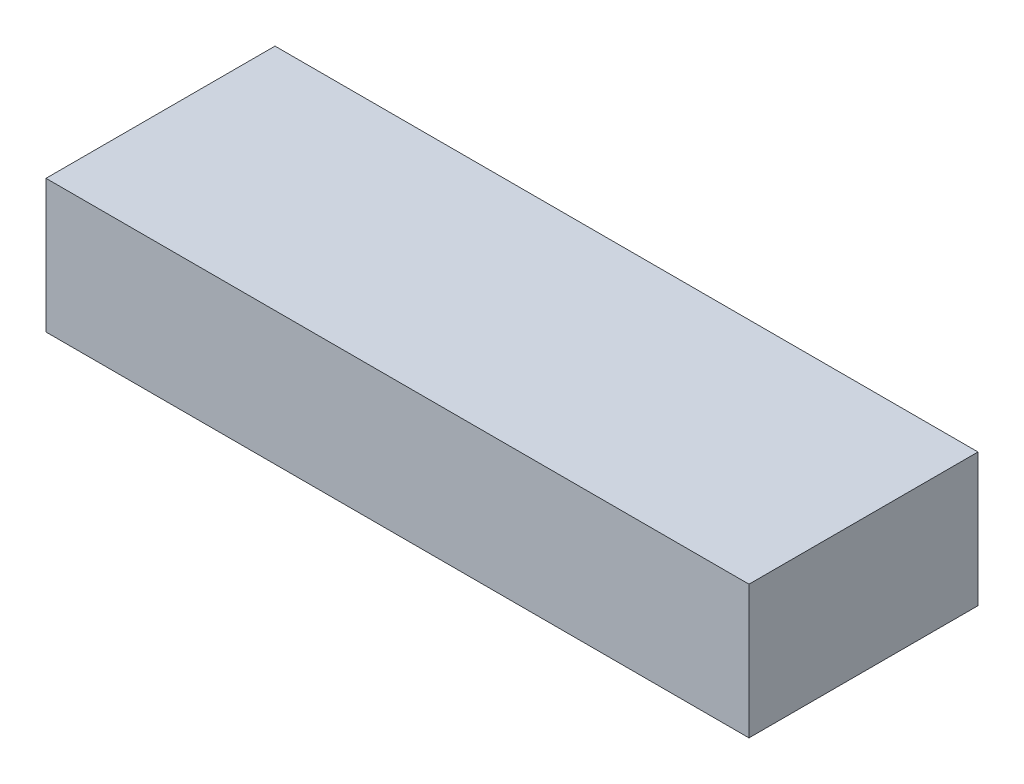
from build123d import *

# Parameters (mm, degrees)
SKETCH2_W           = 132
SKETCH2_H           = 43
BOSS_EXTRUDE1_DEPTH = 25


with BuildPart() as part:
    # Sketch2 → Boss-Extrude1 (new body)
    with BuildSketch(Plane(origin=(0, 0, 0), x_dir=(1, 0, 0), z_dir=(0, 1, 0))):
        with Locations((66, 21.5)):
            Rectangle(SKETCH2_W, SKETCH2_H)
    extrude(amount=BOSS_EXTRUDE1_DEPTH)


solid = part.part
